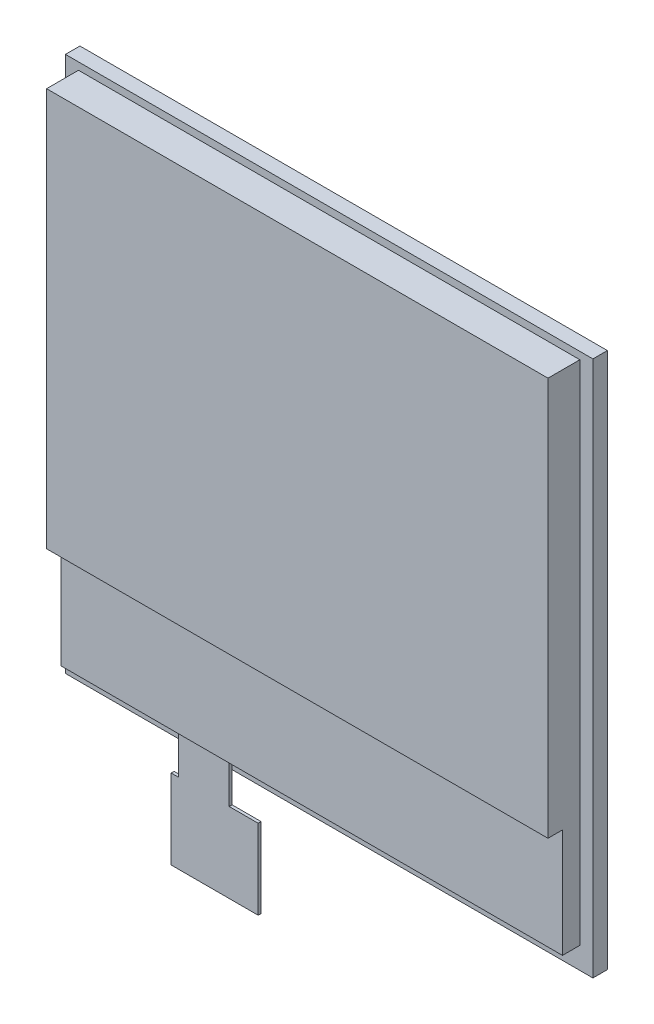
from build123d import *

# Parameters (mm, degrees)
SKETCH1_W           = 36.4
SKETCH1_H           = 37
BOSS_EXTRUDE1_DEPTH = 1
SKETCH2_W           = 34.6
SKETCH2_H           = 27.5
BOSS_EXTRUDE2_DEPTH = 2.2
SKETCH3_W           = 34.6
SKETCH3_H           = 7.5
BOSS_EXTRUDE3_DEPTH = 1.2
BOSS_EXTRUDE4_DEPTH = 0.2
SKETCH5_W           = 3
SKETCH5_H           = 3.5
SKETCH5_W_2         = 1.6
SKETCH5_H_2         = 2.5
BOSS_EXTRUDE5_DEPTH = 0.9


with BuildPart() as part:
    # Sketch1 → Boss-Extrude1 (new body)
    with BuildSketch(Plane.XY):
        Rectangle(SKETCH1_W, SKETCH1_H)
    extrude(amount=BOSS_EXTRUDE1_DEPTH)

    # Sketch2 → Boss-Extrude2 (add)
    with BuildSketch(Plane.XY.offset(1)):
        with Locations((0, 4.25)):
            Rectangle(SKETCH2_W, SKETCH2_H)
    extrude(amount=BOSS_EXTRUDE2_DEPTH)

    # Sketch3 → Boss-Extrude3 (add)
    with BuildSketch(Plane.XY.offset(1)):
        with Locations((0, -13.25)):
            Rectangle(SKETCH3_W, SKETCH3_H)
    extrude(amount=BOSS_EXTRUDE3_DEPTH)

    # Sketch4 → Boss-Extrude4 (add)
    with BuildSketch(Plane.XY.offset(1)):
        Polygon((-10.2, -17), (-6.7, -17), (-6.7, -20.6), (-4.7, -20.6), (-4.7, -26.1), (-10.7, -26.1), (-10.7, -20.6), (-10.2, -20.6), align=None)
    extrude(amount=BOSS_EXTRUDE4_DEPTH)

    # Sketch5 → Boss-Extrude5 (add)
    with BuildSketch(Plane(origin=(0, 0, 1), x_dir=(-1, 0, 0), z_dir=(0, 0, -1))):
        with Locations((7.7, -23.35)):
            Rectangle(SKETCH5_W, SKETCH5_H)
        with Locations((7.7, -23.35)):
            Rectangle(SKETCH5_W_2, SKETCH5_H_2, mode=Mode.SUBTRACT)
    extrude(amount=BOSS_EXTRUDE5_DEPTH)


solid = part.part
